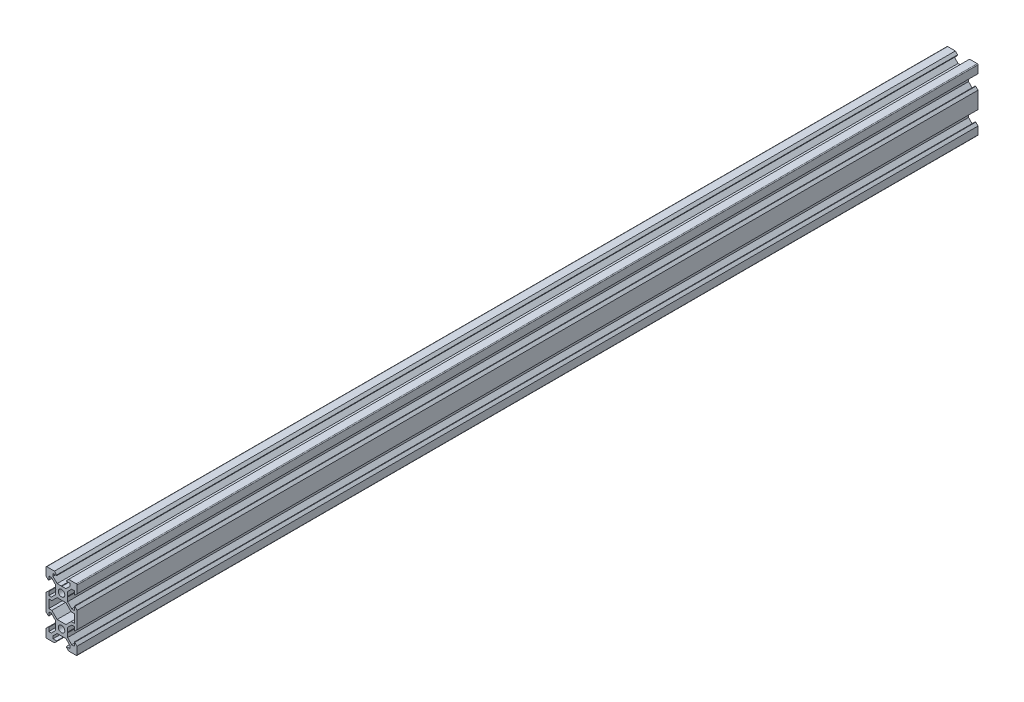
from build123d import *

# Parameters (mm, degrees)
SKETCH2_R           = 2.1
BOSS_EXTRUDE1_DEPTH = 580


with BuildPart() as part:
    # Sketch2 → Boss-Extrude1 (new body)
    with BuildSketch(Plane.XY):
        with BuildLine():
            Line((4.006804208, 10.145798499), (3.796804208, 10.355798499))
            Line((3.796804208, 10.355798499), (4.006804208, 10.565798499))
            Line((4.006804208, 10.565798499), (4.006804208, 13.195138327))
            Line((4.006804208, 13.195138327), (6.66746438, 15.855798499))
            Line((6.66746438, 15.855798499), (8.306804208, 15.855798499))
            Line((8.306804208, 15.855798499), (8.306804208, 13.480798499))
            Line((8.306804208, 13.480798499), (8.651804208, 13.480798499))
            Line((8.651804208, 13.480798499), (10.106804208, 14.935798499))
            Line((10.106804208, 14.935798499), (10.106804208, 19.855798499))
            ThreePointArc((10.106804208, 19.855798499), (9.960357598, 20.209351889), (9.606804208, 20.355798499))
            Line((9.606804208, 20.355798499), (4.686804208, 20.355798499))
            Line((4.686804208, 20.355798499), (3.231804208, 18.900798499))
            Line((3.231804208, 18.900798499), (3.231804208, 18.555798499))
            Line((3.231804208, 18.555798499), (5.606804208, 18.555798499))
            Line((5.606804208, 18.555798499), (5.606804208, 16.91645867))
            Line((5.606804208, 16.91645867), (2.946144036, 14.255798499))
            Line((2.946144036, 14.255798499), (0.316804208, 14.255798499))
            Line((0.316804208, 14.255798499), (0.106804208, 14.045798499))
            Line((0.106804208, 14.045798499), (-0.103195792, 14.255798499))
            Line((-0.103195792, 14.255798499), (-2.73253562, 14.255798499))
            Line((-2.73253562, 14.255798499), (-5.393195792, 16.91645867))
            Line((-5.393195792, 16.91645867), (-5.393195792, 18.555798499))
            Line((-5.393195792, 18.555798499), (-3.018195792, 18.555798499))
            Line((-3.018195792, 18.555798499), (-3.018195792, 18.900798499))
            Line((-3.018195792, 18.900798499), (-4.473195792, 20.355798499))
            Line((-4.473195792, 20.355798499), (-9.393195792, 20.355798499))
            ThreePointArc((-9.393195792, 20.355798499), (-9.746749183, 20.209351889), (-9.893195792, 19.855798499))
            Line((-9.893195792, 19.855798499), (-9.893195792, 14.935798499))
            Line((-9.893195792, 14.935798499), (-8.438195792, 13.480798499))
            Line((-8.438195792, 13.480798499), (-8.093195792, 13.480798499))
            Line((-8.093195792, 13.480798499), (-8.093195792, 15.855798499))
            Line((-8.093195792, 15.855798499), (-6.453855964, 15.855798499))
            Line((-6.453855964, 15.855798499), (-3.793195792, 13.195138327))
            Line((-3.793195792, 13.195138327), (-3.793195792, 10.565798499))
            Line((-3.793195792, 10.565798499), (-3.583195792, 10.355798499))
            Line((-3.583195792, 10.355798499), (-3.793195792, 10.145798499))
            Line((-3.793195792, 10.145798499), (-3.793195792, 7.51645867))
            Line((-3.793195792, 7.51645867), (-6.453855964, 4.855798499))
            Line((-6.453855964, 4.855798499), (-8.093195792, 4.855798499))
            Line((-8.093195792, 4.855798499), (-8.093195792, 7.230798499))
            Line((-8.093195792, 7.230798499), (-8.438195792, 7.230798499))
            Line((-8.438195792, 7.230798499), (-9.893195792, 5.775798499))
            Line((-9.893195792, 5.775798499), (-9.893195792, -5.064201501))
            Line((-9.893195792, -5.064201501), (-8.438195792, -6.519201501))
            Line((-8.438195792, -6.519201501), (-8.093195792, -6.519201501))
            Line((-8.093195792, -6.519201501), (-8.093195792, -4.144201501))
            Line((-8.093195792, -4.144201501), (-6.453855964, -4.144201501))
            Line((-6.453855964, -4.144201501), (-3.793195792, -6.804861673))
            Line((-3.793195792, -6.804861673), (-3.793195792, -9.434201501))
            Line((-3.793195792, -9.434201501), (-3.583195792, -9.644201501))
            Line((-3.583195792, -9.644201501), (-3.793195792, -9.854201501))
            Line((-3.793195792, -9.854201501), (-3.793195792, -12.48354133))
            Line((-3.793195792, -12.48354133), (-6.453855964, -15.144201501))
            Line((-6.453855964, -15.144201501), (-8.093195792, -15.144201501))
            Line((-8.093195792, -15.144201501), (-8.093195792, -12.769201501))
            Line((-8.093195792, -12.769201501), (-8.438195792, -12.769201501))
            Line((-8.438195792, -12.769201501), (-9.893195792, -14.224201501))
            Line((-9.893195792, -14.224201501), (-9.893195792, -19.144201501))
            ThreePointArc((-9.893195792, -19.144201501), (-9.746749183, -19.497754892), (-9.393195792, -19.644201501))
            Line((-9.393195792, -19.644201501), (-4.473195792, -19.644201501))
            Line((-4.473195792, -19.644201501), (-3.018195792, -18.189201501))
            Line((-3.018195792, -18.189201501), (-3.018195792, -17.844201501))
            Line((-3.018195792, -17.844201501), (-5.393195792, -17.844201501))
            Line((-5.393195792, -17.844201501), (-5.393195792, -16.204861673))
            Line((-5.393195792, -16.204861673), (-2.73253562, -13.544201501))
            Line((-2.73253562, -13.544201501), (-0.103195792, -13.544201501))
            Line((-0.103195792, -13.544201501), (0.106804208, -13.334201501))
            Line((0.106804208, -13.334201501), (0.316804208, -13.544201501))
            Line((0.316804208, -13.544201501), (2.946144036, -13.544201501))
            Line((2.946144036, -13.544201501), (5.606804208, -16.204861673))
            Line((5.606804208, -16.204861673), (5.606804208, -17.844201501))
            Line((5.606804208, -17.844201501), (3.231804208, -17.844201501))
            Line((3.231804208, -17.844201501), (3.231804208, -18.189201501))
            Line((3.231804208, -18.189201501), (4.686804208, -19.644201501))
            Line((4.686804208, -19.644201501), (9.606804208, -19.644201501))
            ThreePointArc((9.606804208, -19.644201501), (9.960357598, -19.497754892), (10.106804208, -19.144201501))
            Line((10.106804208, -19.144201501), (10.106804208, -14.224201501))
            Line((10.106804208, -14.224201501), (8.651804208, -12.769201501))
            Line((8.651804208, -12.769201501), (8.306804208, -12.769201501))
            Line((8.306804208, -12.769201501), (8.306804208, -15.144201501))
            Line((8.306804208, -15.144201501), (6.66746438, -15.144201501))
            Line((6.66746438, -15.144201501), (4.006804208, -12.48354133))
            Line((4.006804208, -12.48354133), (4.006804208, -9.854201501))
            Line((4.006804208, -9.854201501), (3.796804208, -9.644201501))
            Line((3.796804208, -9.644201501), (4.006804208, -9.434201501))
            Line((4.006804208, -9.434201501), (4.006804208, -6.804861673))
            Line((4.006804208, -6.804861673), (6.66746438, -4.144201501))
            Line((6.66746438, -4.144201501), (8.306804208, -4.144201501))
            Line((8.306804208, -4.144201501), (8.306804208, -6.519201501))
            Line((8.306804208, -6.519201501), (8.651804208, -6.519201501))
            Line((8.651804208, -6.519201501), (10.106804208, -5.064201501))
            Line((10.106804208, -5.064201501), (10.106804208, 5.775798499))
            Line((10.106804208, 5.775798499), (8.651804208, 7.230798499))
            Line((8.651804208, 7.230798499), (8.306804208, 7.230798499))
            Line((8.306804208, 7.230798499), (8.306804208, 4.855798499))
            Line((8.306804208, 4.855798499), (6.66746438, 4.855798499))
            Line((6.66746438, 4.855798499), (4.006804208, 7.51645867))
            Line((4.006804208, 7.51645867), (4.006804208, 10.145798499))
        make_face()
        with Locations((0.106804208, -9.644201501)):
            Circle(SKETCH2_R, mode=Mode.SUBTRACT)
        with Locations((0.106804208, 10.355798499)):
            Circle(SKETCH2_R, mode=Mode.SUBTRACT)
        Polygon((-6.13253562, -2.344201501), (-2.73253562, -5.744201501), (2.946144036, -5.744201501), (6.346144036, -2.344201501), (8.306804208, -2.344201501), (8.306804208, 3.055798499), (6.346144036, 3.055798499), (2.946144036, 6.455798499), (-2.73253562, 6.455798499), (-6.13253562, 3.055798499), (-8.093195792, 3.055798499), (-8.093195792, -2.344201501), align=None, mode=Mode.SUBTRACT)
    extrude(amount=BOSS_EXTRUDE1_DEPTH)


solid = part.part
